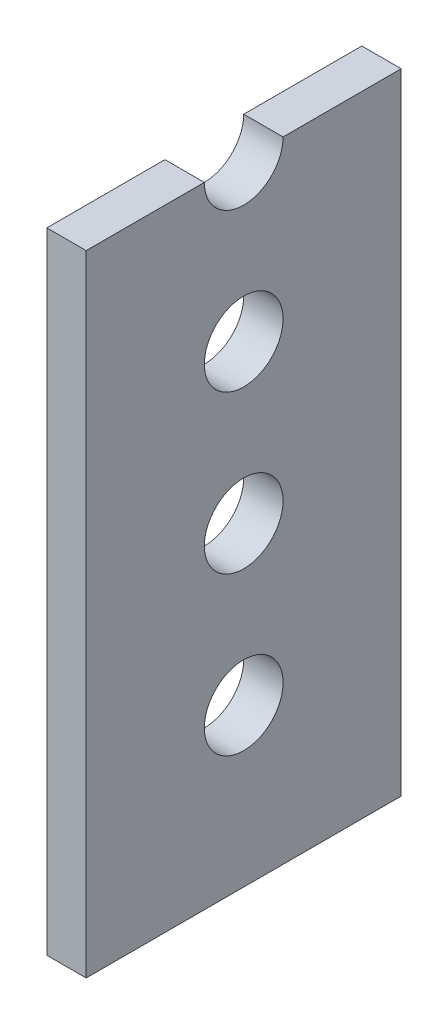
from build123d import *

# Parameters (mm, degrees)
SKETCH1_W               = 25.4
SKETCH1_H               = 1397
SKETCH1_R               = 3.175
BOSS_EXTRUDE1_DEPTH     = 3.175
CUT_EXTRUDE1_DEPTH      = 699.622659685
CUT_EXTRUDE1_DEPTH_BACK = 699.622659685
SKETCH2_W               = 25.4
SKETCH2_H               = 1346.2


with BuildPart() as part:
    # Sketch1 → Boss-Extrude1 (new body)
    with BuildSketch(Plane(origin=(0, 0, 0), x_dir=(0, 0, -1), z_dir=(1, 0, 0))):
        Rectangle(SKETCH1_W, SKETCH1_H)
        with Locations((0, -685.8)):
            Circle(SKETCH1_R, mode=Mode.SUBTRACT)
        with Locations((0, -673.1)):
            Circle(SKETCH1_R, mode=Mode.SUBTRACT)
        with Locations((0, -660.4)):
            Circle(SKETCH1_R, mode=Mode.SUBTRACT)
        with Locations((0, -647.7)):
            Circle(SKETCH1_R, mode=Mode.SUBTRACT)
        with Locations((0, -635)):
            Circle(SKETCH1_R, mode=Mode.SUBTRACT)
        with Locations((0, -622.3)):
            Circle(SKETCH1_R, mode=Mode.SUBTRACT)
        with Locations((0, -609.6)):
            Circle(SKETCH1_R, mode=Mode.SUBTRACT)
        with Locations((0, -596.9)):
            Circle(SKETCH1_R, mode=Mode.SUBTRACT)
        with Locations((0, -584.2)):
            Circle(SKETCH1_R, mode=Mode.SUBTRACT)
        with Locations((0, -571.5)):
            Circle(SKETCH1_R, mode=Mode.SUBTRACT)
        with Locations((0, -558.8)):
            Circle(SKETCH1_R, mode=Mode.SUBTRACT)
        with Locations((0, -546.1)):
            Circle(SKETCH1_R, mode=Mode.SUBTRACT)
        with Locations((0, -533.4)):
            Circle(SKETCH1_R, mode=Mode.SUBTRACT)
        with Locations((0, -520.7)):
            Circle(SKETCH1_R, mode=Mode.SUBTRACT)
        with Locations((0, -508)):
            Circle(SKETCH1_R, mode=Mode.SUBTRACT)
        with Locations((0, -495.3)):
            Circle(SKETCH1_R, mode=Mode.SUBTRACT)
        with Locations((0, -482.6)):
            Circle(SKETCH1_R, mode=Mode.SUBTRACT)
        with Locations((0, -469.9)):
            Circle(SKETCH1_R, mode=Mode.SUBTRACT)
        with Locations((0, -457.2)):
            Circle(SKETCH1_R, mode=Mode.SUBTRACT)
        with Locations((0, -444.5)):
            Circle(SKETCH1_R, mode=Mode.SUBTRACT)
        with Locations((0, -431.8)):
            Circle(SKETCH1_R, mode=Mode.SUBTRACT)
        with Locations((0, -419.1)):
            Circle(SKETCH1_R, mode=Mode.SUBTRACT)
        with Locations((0, -406.4)):
            Circle(SKETCH1_R, mode=Mode.SUBTRACT)
        with Locations((0, -393.7)):
            Circle(SKETCH1_R, mode=Mode.SUBTRACT)
        with Locations((0, -381)):
            Circle(SKETCH1_R, mode=Mode.SUBTRACT)
        with Locations((0, -368.3)):
            Circle(SKETCH1_R, mode=Mode.SUBTRACT)
        with Locations((0, -355.6)):
            Circle(SKETCH1_R, mode=Mode.SUBTRACT)
        with Locations((0, -342.9)):
            Circle(SKETCH1_R, mode=Mode.SUBTRACT)
        with Locations((0, -330.2)):
            Circle(SKETCH1_R, mode=Mode.SUBTRACT)
        with Locations((0, -317.5)):
            Circle(SKETCH1_R, mode=Mode.SUBTRACT)
        with Locations((0, -304.8)):
            Circle(SKETCH1_R, mode=Mode.SUBTRACT)
        with Locations((0, -292.1)):
            Circle(SKETCH1_R, mode=Mode.SUBTRACT)
        with Locations((0, -279.4)):
            Circle(SKETCH1_R, mode=Mode.SUBTRACT)
        with Locations((0, -266.7)):
            Circle(SKETCH1_R, mode=Mode.SUBTRACT)
        with Locations((0, -254)):
            Circle(SKETCH1_R, mode=Mode.SUBTRACT)
        with Locations((0, -241.3)):
            Circle(SKETCH1_R, mode=Mode.SUBTRACT)
        with Locations((0, -228.6)):
            Circle(SKETCH1_R, mode=Mode.SUBTRACT)
        with Locations((0, -215.9)):
            Circle(SKETCH1_R, mode=Mode.SUBTRACT)
        with Locations((0, -203.2)):
            Circle(SKETCH1_R, mode=Mode.SUBTRACT)
        with Locations((0, -190.5)):
            Circle(SKETCH1_R, mode=Mode.SUBTRACT)
        with Locations((0, -177.8)):
            Circle(SKETCH1_R, mode=Mode.SUBTRACT)
        with Locations((0, -165.1)):
            Circle(SKETCH1_R, mode=Mode.SUBTRACT)
        with Locations((0, -152.4)):
            Circle(SKETCH1_R, mode=Mode.SUBTRACT)
        with Locations((0, -139.7)):
            Circle(SKETCH1_R, mode=Mode.SUBTRACT)
        with Locations((0, -127)):
            Circle(SKETCH1_R, mode=Mode.SUBTRACT)
        with Locations((0, -114.3)):
            Circle(SKETCH1_R, mode=Mode.SUBTRACT)
        with Locations((0, -101.6)):
            Circle(SKETCH1_R, mode=Mode.SUBTRACT)
        with Locations((0, -88.9)):
            Circle(SKETCH1_R, mode=Mode.SUBTRACT)
        with Locations((0, -76.2)):
            Circle(SKETCH1_R, mode=Mode.SUBTRACT)
        with Locations((0, -63.5)):
            Circle(SKETCH1_R, mode=Mode.SUBTRACT)
        with Locations((0, -50.8)):
            Circle(SKETCH1_R, mode=Mode.SUBTRACT)
        with Locations((0, -38.1)):
            Circle(SKETCH1_R, mode=Mode.SUBTRACT)
        with Locations((0, -25.4)):
            Circle(SKETCH1_R, mode=Mode.SUBTRACT)
        with Locations((0, -12.7)):
            Circle(SKETCH1_R, mode=Mode.SUBTRACT)
        Circle(SKETCH1_R, mode=Mode.SUBTRACT)
        with Locations((0, 12.7)):
            Circle(SKETCH1_R, mode=Mode.SUBTRACT)
        with Locations((0, 25.4)):
            Circle(SKETCH1_R, mode=Mode.SUBTRACT)
        with Locations((0, 38.1)):
            Circle(SKETCH1_R, mode=Mode.SUBTRACT)
        with Locations((0, 50.8)):
            Circle(SKETCH1_R, mode=Mode.SUBTRACT)
        with Locations((0, 63.5)):
            Circle(SKETCH1_R, mode=Mode.SUBTRACT)
        with Locations((0, 76.2)):
            Circle(SKETCH1_R, mode=Mode.SUBTRACT)
        with Locations((0, 88.9)):
            Circle(SKETCH1_R, mode=Mode.SUBTRACT)
        with Locations((0, 101.6)):
            Circle(SKETCH1_R, mode=Mode.SUBTRACT)
        with Locations((0, 114.3)):
            Circle(SKETCH1_R, mode=Mode.SUBTRACT)
        with Locations((0, 127)):
            Circle(SKETCH1_R, mode=Mode.SUBTRACT)
        with Locations((0, 139.7)):
            Circle(SKETCH1_R, mode=Mode.SUBTRACT)
        with Locations((0, 152.4)):
            Circle(SKETCH1_R, mode=Mode.SUBTRACT)
        with Locations((0, 165.1)):
            Circle(SKETCH1_R, mode=Mode.SUBTRACT)
        with Locations((0, 177.8)):
            Circle(SKETCH1_R, mode=Mode.SUBTRACT)
        with Locations((0, 190.5)):
            Circle(SKETCH1_R, mode=Mode.SUBTRACT)
        with Locations((0, 203.2)):
            Circle(SKETCH1_R, mode=Mode.SUBTRACT)
        with Locations((0, 215.9)):
            Circle(SKETCH1_R, mode=Mode.SUBTRACT)
        with Locations((0, 228.6)):
            Circle(SKETCH1_R, mode=Mode.SUBTRACT)
        with Locations((0, 241.3)):
            Circle(SKETCH1_R, mode=Mode.SUBTRACT)
        with Locations((0, 254)):
            Circle(SKETCH1_R, mode=Mode.SUBTRACT)
        with Locations((0, 266.7)):
            Circle(SKETCH1_R, mode=Mode.SUBTRACT)
        with Locations((0, 279.4)):
            Circle(SKETCH1_R, mode=Mode.SUBTRACT)
        with Locations((0, 292.1)):
            Circle(SKETCH1_R, mode=Mode.SUBTRACT)
        with Locations((0, 304.8)):
            Circle(SKETCH1_R, mode=Mode.SUBTRACT)
        with Locations((0, 317.5)):
            Circle(SKETCH1_R, mode=Mode.SUBTRACT)
        with Locations((0, 330.2)):
            Circle(SKETCH1_R, mode=Mode.SUBTRACT)
        with Locations((0, 342.9)):
            Circle(SKETCH1_R, mode=Mode.SUBTRACT)
        with Locations((0, 355.6)):
            Circle(SKETCH1_R, mode=Mode.SUBTRACT)
        with Locations((0, 368.3)):
            Circle(SKETCH1_R, mode=Mode.SUBTRACT)
        with Locations((0, 381)):
            Circle(SKETCH1_R, mode=Mode.SUBTRACT)
        with Locations((0, 393.7)):
            Circle(SKETCH1_R, mode=Mode.SUBTRACT)
        with Locations((0, 406.4)):
            Circle(SKETCH1_R, mode=Mode.SUBTRACT)
        with Locations((0, 419.1)):
            Circle(SKETCH1_R, mode=Mode.SUBTRACT)
        with Locations((0, 431.8)):
            Circle(SKETCH1_R, mode=Mode.SUBTRACT)
        with Locations((0, 444.5)):
            Circle(SKETCH1_R, mode=Mode.SUBTRACT)
        with Locations((0, 457.2)):
            Circle(SKETCH1_R, mode=Mode.SUBTRACT)
        with Locations((0, 469.9)):
            Circle(SKETCH1_R, mode=Mode.SUBTRACT)
        with Locations((0, 482.6)):
            Circle(SKETCH1_R, mode=Mode.SUBTRACT)
        with Locations((0, 495.3)):
            Circle(SKETCH1_R, mode=Mode.SUBTRACT)
        with Locations((0, 508)):
            Circle(SKETCH1_R, mode=Mode.SUBTRACT)
        with Locations((0, 520.7)):
            Circle(SKETCH1_R, mode=Mode.SUBTRACT)
        with Locations((0, 533.4)):
            Circle(SKETCH1_R, mode=Mode.SUBTRACT)
        with Locations((0, 546.1)):
            Circle(SKETCH1_R, mode=Mode.SUBTRACT)
        with Locations((0, 558.8)):
            Circle(SKETCH1_R, mode=Mode.SUBTRACT)
        with Locations((0, 571.5)):
            Circle(SKETCH1_R, mode=Mode.SUBTRACT)
        with Locations((0, 584.2)):
            Circle(SKETCH1_R, mode=Mode.SUBTRACT)
        with Locations((0, 596.9)):
            Circle(SKETCH1_R, mode=Mode.SUBTRACT)
        with Locations((0, 609.6)):
            Circle(SKETCH1_R, mode=Mode.SUBTRACT)
        with Locations((0, 622.3)):
            Circle(SKETCH1_R, mode=Mode.SUBTRACT)
        with Locations((0, 635)):
            Circle(SKETCH1_R, mode=Mode.SUBTRACT)
        with Locations((0, 647.7)):
            Circle(SKETCH1_R, mode=Mode.SUBTRACT)
        with Locations((0, 660.4)):
            Circle(SKETCH1_R, mode=Mode.SUBTRACT)
        with Locations((0, 673.1)):
            Circle(SKETCH1_R, mode=Mode.SUBTRACT)
        with Locations((0, 685.8)):
            Circle(SKETCH1_R, mode=Mode.SUBTRACT)
    extrude(amount=BOSS_EXTRUDE1_DEPTH)

    # Sketch2 → Cut-Extrude1 (cut, two sides: drawn at the far end of the back side and taken through both)
    with BuildSketch(Plane(origin=(3.175, 0, 0), x_dir=(0, 0, -1), z_dir=(1, 0, 0)).offset(-CUT_EXTRUDE1_DEPTH_BACK)):
        with Locations((0, 25.4)):
            Rectangle(SKETCH2_W, SKETCH2_H)
    extrude(amount=CUT_EXTRUDE1_DEPTH + CUT_EXTRUDE1_DEPTH_BACK, mode=Mode.SUBTRACT)


solid = part.part
